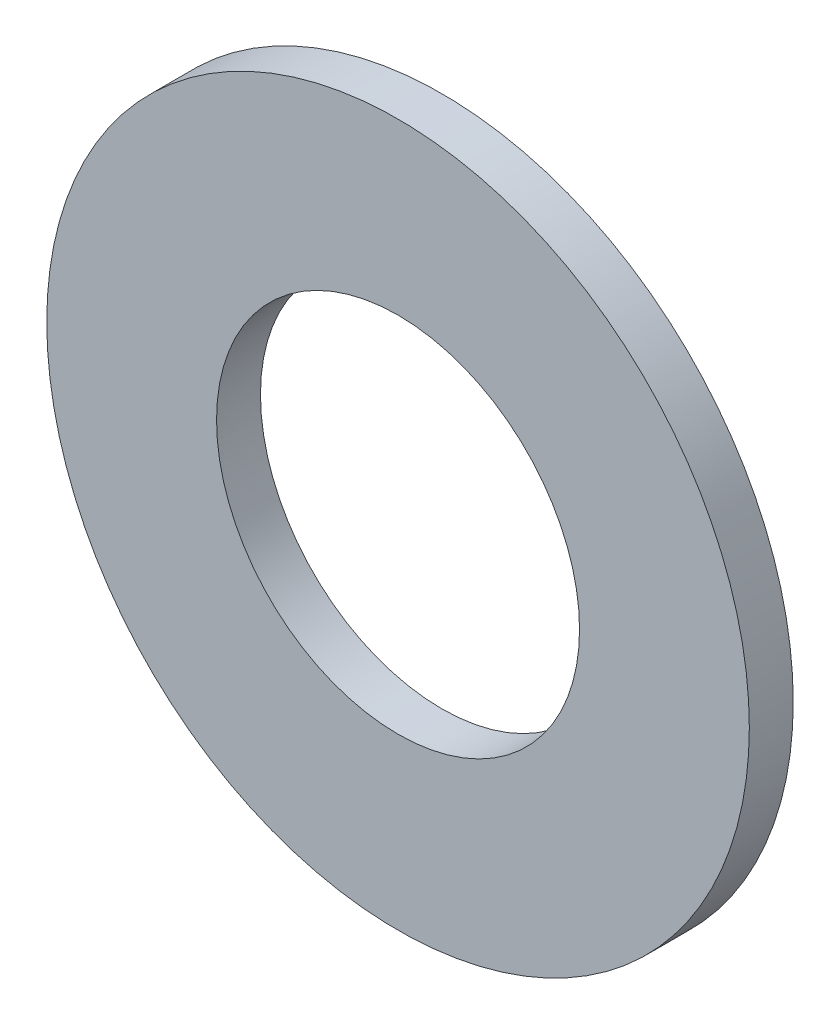
from build123d import *

# Parameters (mm, degrees)
SKETCH1_R           = 6
SKETCH1_R_2         = 3.1
BOSS_EXTRUDE1_DEPTH = 0.75


with BuildPart() as part:
    # Sketch1 → Boss-Extrude1 (new body)
    with BuildSketch(Plane.XY):
        Circle(SKETCH1_R)
        Circle(SKETCH1_R_2, mode=Mode.SUBTRACT)
    extrude(amount=BOSS_EXTRUDE1_DEPTH)


solid = part.part
